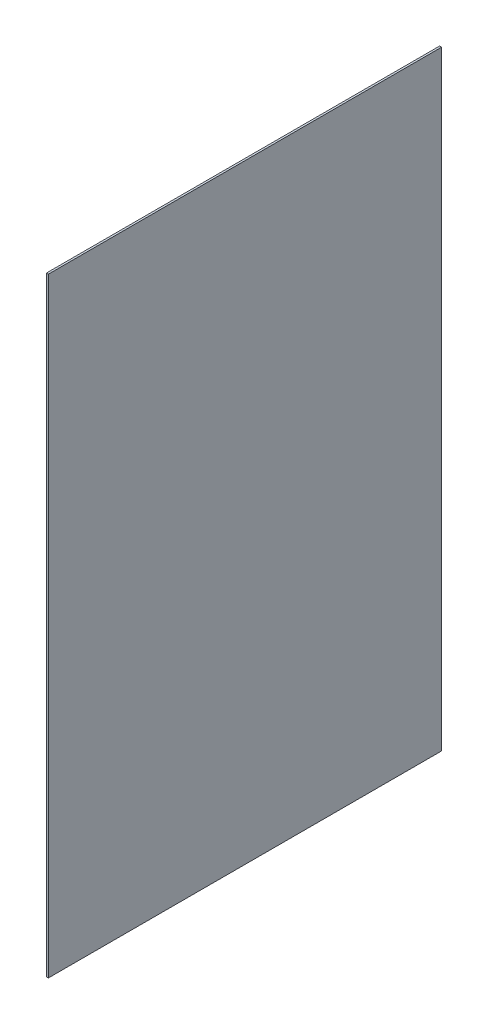
from build123d import *

# Parameters (mm, degrees)
SKETCH2_W           = 508
SKETCH2_H           = 787.4
BOSS_EXTRUDE1_DEPTH = 2.54


with BuildPart() as part:
    # Sketch2 → Boss-Extrude1 (new body)
    with BuildSketch(Plane(origin=(0, 0, 0), x_dir=(0, 0, -1), z_dir=(1, 0, 0))):
        Rectangle(SKETCH2_W, SKETCH2_H)
    extrude(amount=BOSS_EXTRUDE1_DEPTH)


solid = part.part
